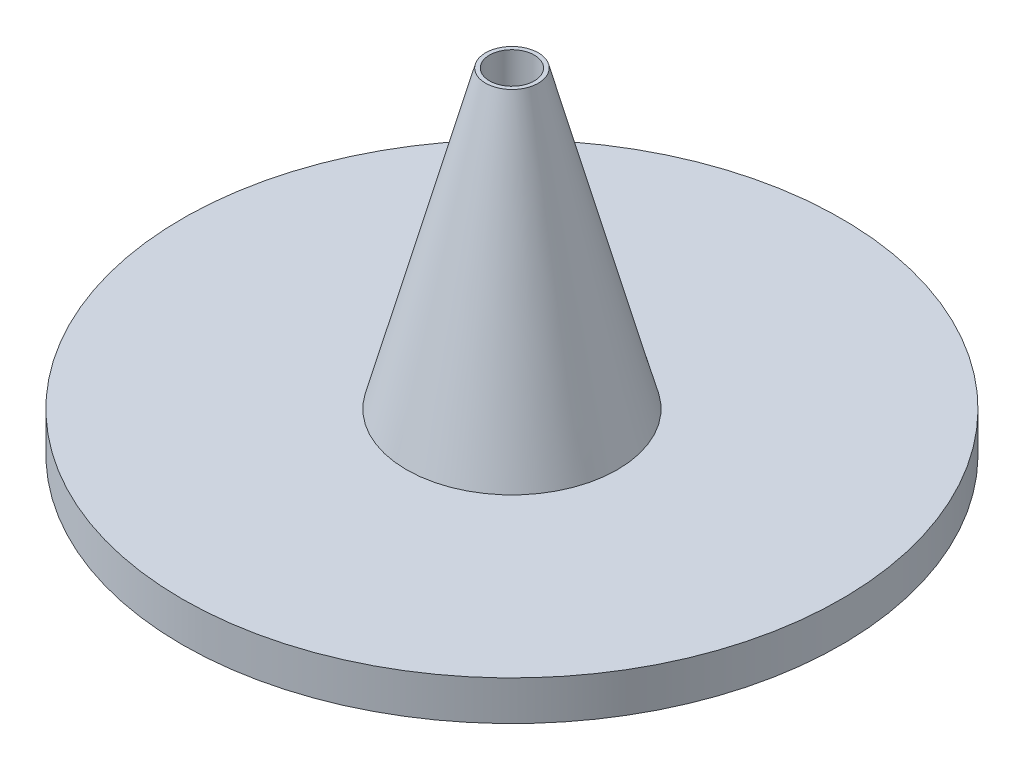
from build123d import *

# Parameters (mm, degrees)
SKETCH1_R           = 25
BOSS_EXTRUDE1_DEPTH = 3
SKETCH3_R           = 1.7
CUT_EXTRUDE1_DEPTH  = 44.528946063


with BuildPart() as part:
    # Sketch1 → Boss-Extrude1 (new body)
    with BuildSketch(Plane(origin=(0, 0, 0), x_dir=(1, 0, 0), z_dir=(0, 1, 0))):
        with Locations(Location((0, 0, 0), (0, 0, 270))):
            Circle(SKETCH1_R)
    extrude(amount=BOSS_EXTRUDE1_DEPTH)

    # Sketch2 → Revolve1 (revolve)
    with BuildSketch(Plane(origin=(0, 0, 0), x_dir=(0, 0, -1), z_dir=(1, 0, 0)), mode=Mode.PRIVATE) as revolve1_sk:
        Polygon((-8, 3), (-2, 25.392304845), (0, 25.392304845), (0, 3), align=None)
    revolve(revolve1_sk.sketch.rotate(Axis((0, 0, 0), (0, 1, 0)), 180), axis=Axis((0, 0, 0), (0, 1, 0)))

    # Sketch3 → Cut-Extrude1 (cut, through all)
    with BuildSketch(Plane(origin=(0, 25.392304845, 0), x_dir=(1, 0, 0), z_dir=(0, 1, 0))):
        with Locations(Location((0, 0, 0), (0, 0, 270))):
            Circle(SKETCH3_R)
    extrude(amount=-CUT_EXTRUDE1_DEPTH, mode=Mode.SUBTRACT)


solid = part.part
